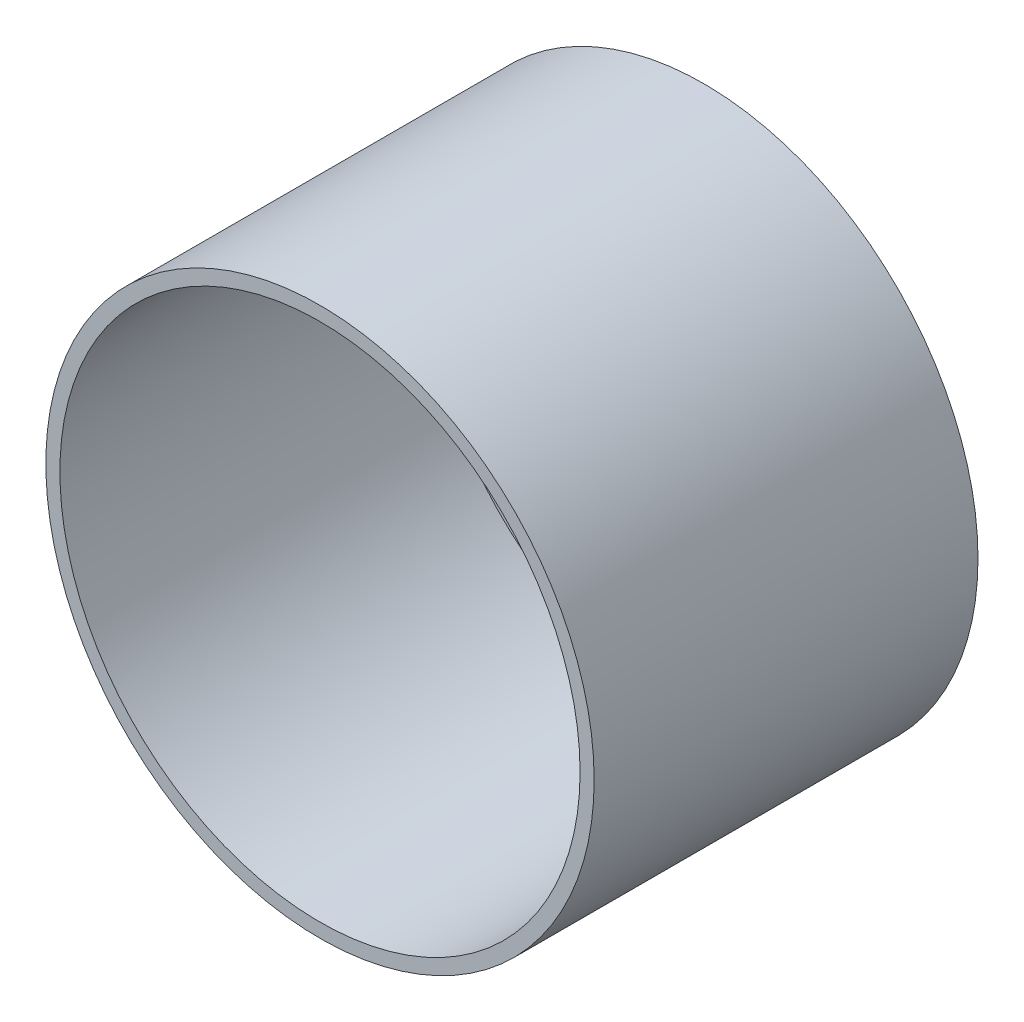
from build123d import *

# Parameters (mm, degrees)
ESQUISSE4_R        = 75
BOSS_EXTRU_3_DEPTH = 5
ESQUISSE5_R        = 75
ESQUISSE5_R_2      = 71.150849087
BOSS_EXTRU_4_DEPTH = 100


with BuildPart() as part:
    # Esquisse4 → Boss.-Extru.3 (new body)
    with BuildSketch(Plane.XY):
        Circle(ESQUISSE4_R)
    extrude(amount=BOSS_EXTRU_3_DEPTH)

    # Esquisse5 → Boss.-Extru.4 (add)
    with BuildSketch(Plane.XY.offset(5)):
        Circle(ESQUISSE5_R)
        Circle(ESQUISSE5_R_2, mode=Mode.SUBTRACT)
    extrude(amount=BOSS_EXTRU_4_DEPTH)


solid = part.part
